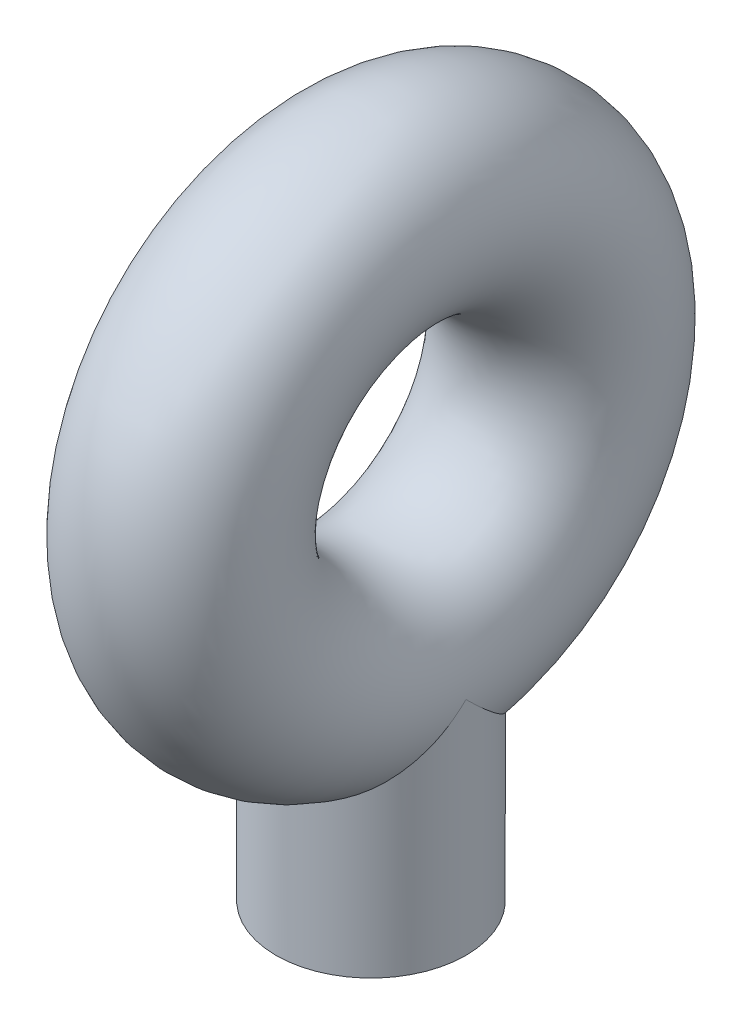
from build123d import *

# Parameters (mm, degrees)
SKETCH2_R           = 1.5
BOSS_EXTRUDE1_DEPTH = 3.5
SKETCH6_R           = 1.5


with BuildPart() as part:
    # Sketch2 → Boss-Extrude1 (new body)
    with BuildSketch(Plane(origin=(0, 0, 0), x_dir=(1, 0, 0), z_dir=(0, 1, 0))):
        with Locations(Location((0, 0, 0), (0, 0, 270))):
            Circle(SKETCH2_R)
    extrude(amount=BOSS_EXTRUDE1_DEPTH)

    # Sketch6 → Revolve1 (revolve)
    with BuildSketch(Plane.XY, mode=Mode.PRIVATE) as revolve1_sk:
        with Locations((0, 3.5)):
            Circle(SKETCH6_R)
    revolve(revolve1_sk.sketch.rotate(Axis((0, 6.5, 0), (1, 0, 0)), 144.735583815), axis=Axis((0, 6.5, 0), (1, 0, 0)))


solid = part.part
